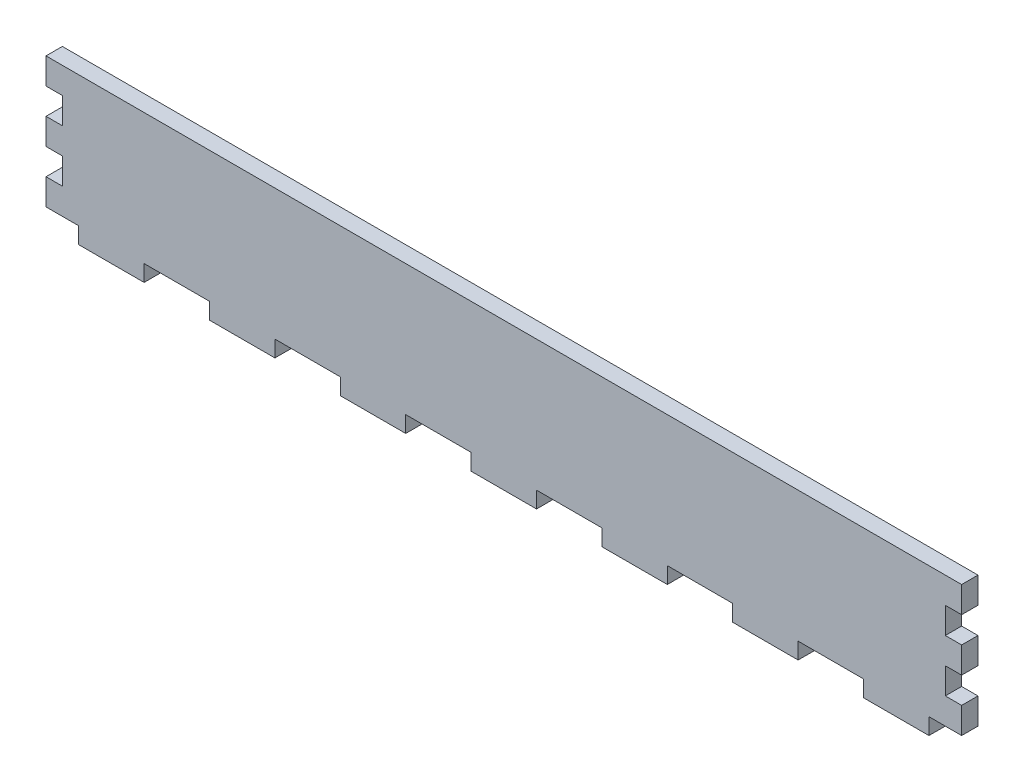
from build123d import *

# Parameters (mm, degrees)
ESQUISSE1_W                     = 355.6
ESQUISSE1_H                     = 50.8
BOSS_EXTRU_1_DEPTH              = 6.35
ESQUISSE2_W                     = 6.35
ESQUISSE2_H                     = 10.16
ENL_V_MAT_EXTRU_1_DEPTH         = 180.717340566
R_P_TITION_LIN_AIRE1_COUNT      = 2
R_P_TITION_LIN_AIRE1_PITCH      = 20.32
R_P_TITION_LIN_AIRE1_COUNT_DIR2 = 2
R_P_TITION_LIN_AIRE1_PITCH_DIR2 = 349.25
ESQUISSE3_W                     = 25.4
ESQUISSE3_H                     = 6.35
BOSS_EXTRU_2_DEPTH              = 6.35
R_P_TITION_LIN_AIRE2_COUNT      = 7
R_P_TITION_LIN_AIRE2_PITCH      = 50.8


with BuildPart() as part:
    # Esquisse1 → Boss.-Extru.1 (new body)
    with BuildSketch(Plane.XY):
        Rectangle(ESQUISSE1_W, ESQUISSE1_H)
    extrude(amount=BOSS_EXTRU_1_DEPTH)

    # Esquisse2 → Enlèv. mat.-Extru.1 (cut, through all)
    with BuildSketch(Plane.XY.offset(6.35)):
        with Locations((-174.625, -10.16)):
            Rectangle(ESQUISSE2_W, ESQUISSE2_H)
    enl_v_mat_extru_1 = extrude(amount=-ENL_V_MAT_EXTRU_1_DEPTH, mode=Mode.SUBTRACT)

    # Répétition linéaire1: Enl_v. mat.-Extru.1 2 × 2
    with Locations(*[(j * R_P_TITION_LIN_AIRE1_PITCH_DIR2, i * R_P_TITION_LIN_AIRE1_PITCH, 0) for i in range(R_P_TITION_LIN_AIRE1_COUNT) for j in range(R_P_TITION_LIN_AIRE1_COUNT_DIR2) if (i, j) != (0, 0)]):
        add(enl_v_mat_extru_1, mode=Mode.SUBTRACT)

    # Esquisse3 → Boss.-Extru.2 (add)
    with BuildSketch(Plane.XY.offset(6.35)):
        with Locations((-152.4, -28.575)):
            Rectangle(ESQUISSE3_W, ESQUISSE3_H)
    boss_extru_2 = extrude(amount=-BOSS_EXTRU_2_DEPTH)

    # Répétition linéaire2: Boss.-Extru.2 ×7
    with Locations(*[(i * R_P_TITION_LIN_AIRE2_PITCH, 0, 0) for i in range(1, R_P_TITION_LIN_AIRE2_COUNT)]):
        add(boss_extru_2)


solid = part.part
